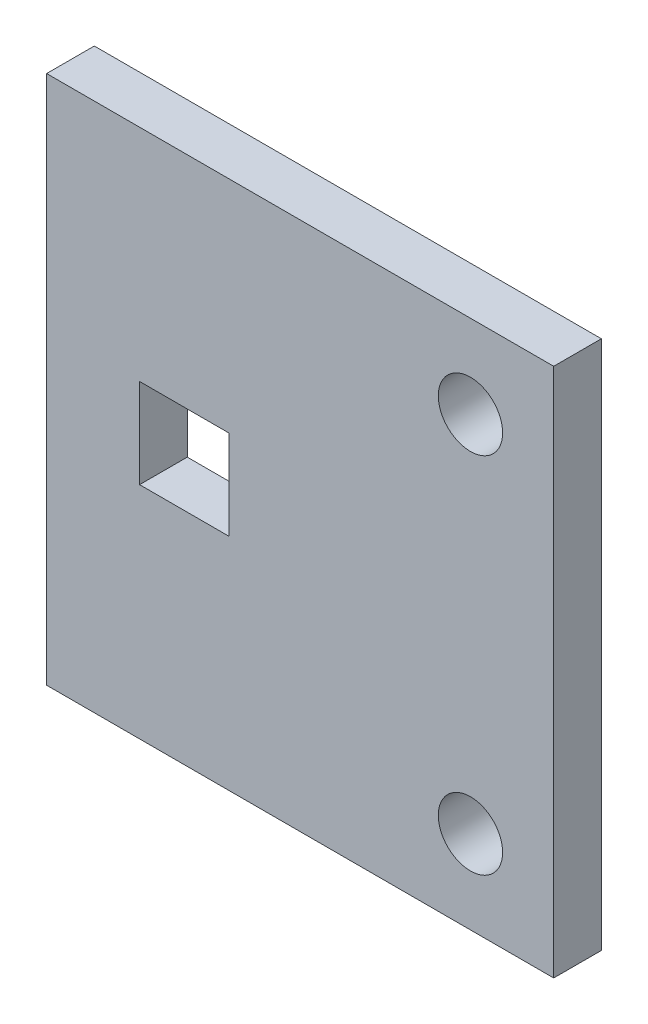
from build123d import *

# Parameters (mm, degrees)
SKETCH1_W           = 17.018
SKETCH1_H           = 17.78
SKETCH1_R           = 1.0795
SKETCH1_W_2         = 3
SKETCH1_H_2         = 3
BOSS_EXTRUDE1_DEPTH = 1.6


with BuildPart() as part:
    # Sketch1 → Boss-Extrude1 (new body)
    with BuildSketch(Plane.XY):
        Rectangle(SKETCH1_W, SKETCH1_H)
        with Locations((5.715, 6.096)):
            Circle(SKETCH1_R, mode=Mode.SUBTRACT)
        with Locations((5.715, -6.096)):
            Circle(SKETCH1_R, mode=Mode.SUBTRACT)
        with Locations((-3.889, 0)):
            Rectangle(SKETCH1_W_2, SKETCH1_H_2, mode=Mode.SUBTRACT)
    extrude(amount=BOSS_EXTRUDE1_DEPTH)


solid = part.part
